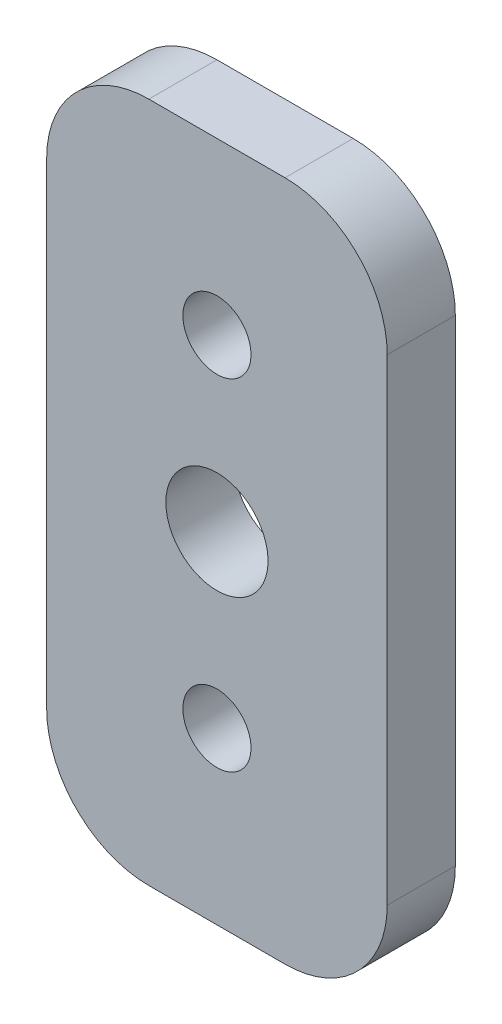
from build123d import *

# Parameters (mm, degrees)
ESQUISSE3_W             = 50
ESQUISSE3_H             = 100
BOSS_EXTRU_2_DEPTH      = 10
CONG_1_R                = 15
ESQUISSE4_R             = 5
ESQUISSE4_R_2           = 7.5
ENL_V_MAT_EXTRU_1_DEPTH = 10


with BuildPart() as part:
    # Esquisse3 → Boss.-Extru.2 (new body)
    with BuildSketch(Plane.XY):
        Rectangle(ESQUISSE3_W, ESQUISSE3_H)
    extrude(amount=BOSS_EXTRU_2_DEPTH)

    # Congé1
    cong_1_edges = [part.edges().sort_by_distance(p)[0] for p in [
        (-25, 50, 5),
        (25, 50, 5),
        (25, -50, 5),
        (-25, -50, 5),
    ]]
    fillet(cong_1_edges, radius=CONG_1_R)

    # Esquisse4 → Enlèv. mat.-Extru.1 (cut)
    with BuildSketch(Plane(origin=(0, 0, 0), x_dir=(-1, 0, 0), z_dir=(0, 0, -1))):
        with Locations((0, -25)):
            Circle(ESQUISSE4_R)
        with Locations((0, 25)):
            Circle(ESQUISSE4_R)
        Circle(ESQUISSE4_R_2)
    extrude(amount=-ENL_V_MAT_EXTRU_1_DEPTH, mode=Mode.SUBTRACT)


solid = part.part
